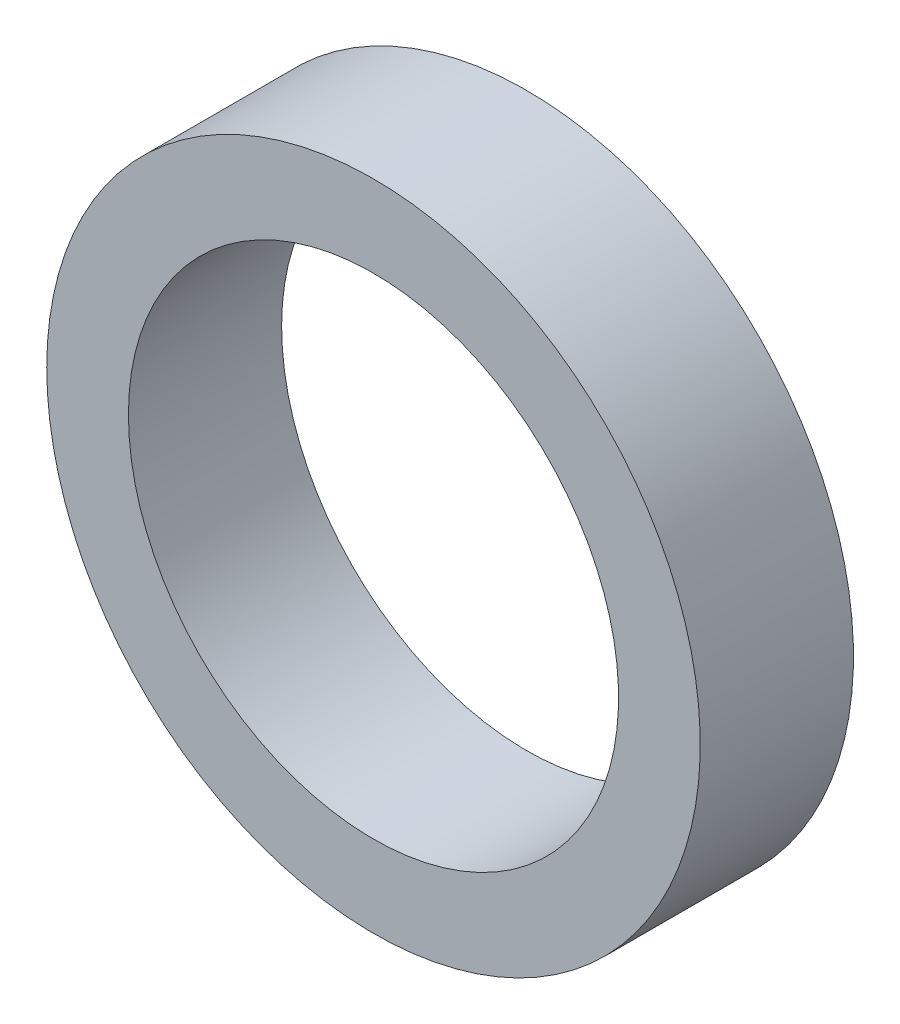
from build123d import *

# Parameters (mm, degrees)
SKETCH1_R           = 10.16
SKETCH1_R_2         = 7.62
BOSS_EXTRUDE1_DEPTH = 4.7625


with BuildPart() as part:
    # Sketch1 → Boss-Extrude1 (new body)
    with BuildSketch(Plane.XY):
        with Locations(Location((0, 0, 0), (0, 0, 180))):
            Circle(SKETCH1_R)
        with Locations(Location((0, 0, 0), (0, 0, 180))):
            Circle(SKETCH1_R_2, mode=Mode.SUBTRACT)
    extrude(amount=BOSS_EXTRUDE1_DEPTH)


solid = part.part
